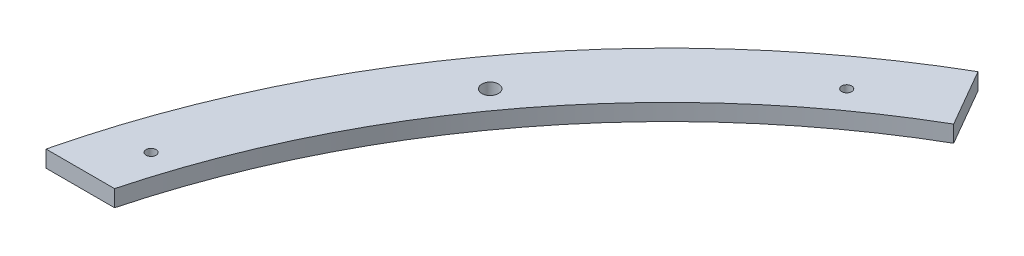
from build123d import *

# Parameters (mm, degrees)
SKETCH1_R           = 254.5
SKETCH1_R_2         = 234.5
BOSS_EXTRUDE1_DEPTH = 5
SKETCH2_W           = 27.805822748
SKETCH2_H           = 60
CUT_EXTRUDE1_DEPTH  = 5
SKETCH3_R           = 2.5
CUT_EXTRUDE2_DEPTH  = 5
SKETCH4_R           = 1.5
CUT_EXTRUDE3_DEPTH  = 5
SKETCH5_W           = 651.212620435
SKETCH5_H           = 357.226439325
CUT_EXTRUDE4_DEPTH  = 10
CUT_EXTRUDE5_START  = -10
CUT_EXTRUDE5_DEPTH  = 10


with BuildPart() as part:
    # Sketch1 → Boss-Extrude1 (new body)
    with BuildSketch(Plane(origin=(0, 0, 0), x_dir=(1, 0, 0), z_dir=(0, 1, 0))):
        with Locations(Location((0, 0, 0), (0, 0, 270))):
            Circle(SKETCH1_R)
        with Locations(Location((0, 0, 0), (0, 0, 270))):
            Circle(SKETCH1_R_2, mode=Mode.SUBTRACT)
    extrude(amount=BOSS_EXTRUDE1_DEPTH)

    # Sketch2 → Cut-Extrude1 (cut)
    with BuildSketch(Plane(origin=(0, 5, 0), x_dir=(1, 0, 0), z_dir=(0, 1, 0))):
        with Locations((-240.597088626, 30)):
            Rectangle(SKETCH2_W, SKETCH2_H)
    cut_extrude1 = extrude(amount=-CUT_EXTRUDE1_DEPTH, mode=Mode.SUBTRACT)

    # Mirror1: Cut-Extrude1 across plane
    add(cut_extrude1.mirror(Plane.XY), mode=Mode.SUBTRACT)

    # Sketch3 → Cut-Extrude2 (cut)
    with BuildSketch(Plane(origin=(0, 5, 0), x_dir=(1, 0, 0), z_dir=(0, 1, 0))):
        with Locations(Location((242.5, 0, 0), (0, 0, 270))):
            Circle(SKETCH3_R)
        with Locations(Location((196.186621136, -142.537923681, 0), (0, 0, 270))):
            Circle(SKETCH3_R)
        with Locations(Location((74.936621136, -230.631205202, 0), (0, 0, 270))):
            Circle(SKETCH3_R)
        with Locations(Location((-74.936621136, -230.631205202, 0), (0, 0, 270))):
            Circle(SKETCH3_R)
        with Locations(Location((-196.186621136, -142.537923681, 0), (0, 0, 270))):
            Circle(SKETCH3_R)
        with Locations((-242.5, 0)):
            Circle(SKETCH3_R)
        with Locations(Location((-196.186621136, 142.537923681, 0), (0, 0, 270))):
            Circle(SKETCH3_R)
        with Locations(Location((-74.936621136, 230.631205202, 0), (0, 0, 270))):
            Circle(SKETCH3_R)
        with Locations(Location((74.936621136, 230.631205202, 0), (0, 0, 270))):
            Circle(SKETCH3_R)
        with Locations(Location((196.186621136, 142.537923681, 0), (0, 0, 270))):
            Circle(SKETCH3_R)
    extrude(amount=-CUT_EXTRUDE2_DEPTH, mode=Mode.SUBTRACT)

    # Sketch4 → Cut-Extrude3 (cut)
    with BuildSketch(Plane(origin=(0, 5, 0), x_dir=(1, 0, 0), z_dir=(0, 1, 0))):
        with Locations(Location((0, -242.5, 0), (0, 0, 270))):
            Circle(SKETCH4_R)
        with Locations(Location((-142.537923681, -196.186621136, 0), (0, 0, 270))):
            Circle(SKETCH4_R)
        with Locations(Location((-230.631205202, -74.936621136, 0), (0, 0, 270))):
            Circle(SKETCH4_R)
        with Locations(Location((-230.631205202, 74.936621136, 0), (0, 0, 270))):
            Circle(SKETCH4_R)
        with Locations(Location((-142.537923681, 196.186621136, 0), (0, 0, 270))):
            Circle(SKETCH4_R)
        with Locations(Location((0, 242.5, 0), (0, 0, 270))):
            Circle(SKETCH4_R)
        with Locations(Location((142.537923681, 196.186621136, 0), (0, 0, 270))):
            Circle(SKETCH4_R)
        with Locations(Location((230.631205202, 74.936621136, 0), (0, 0, 270))):
            Circle(SKETCH4_R)
        with Locations(Location((230.631205202, -74.936621136, 0), (0, 0, 270))):
            Circle(SKETCH4_R)
        with Locations(Location((142.537923681, -196.186621136, 0), (0, 0, 270))):
            Circle(SKETCH4_R)
    extrude(amount=-CUT_EXTRUDE3_DEPTH, mode=Mode.SUBTRACT)

    # Sketch5 → Cut-Extrude4 (cut)
    with BuildSketch(Plane(origin=(0, 5, 0), x_dir=(1, 0, 0), z_dir=(0, 1, 0))):
        with Locations((-71.106310217, -178.613219663)):
            Rectangle(SKETCH5_W, SKETCH5_H)
    extrude(amount=-CUT_EXTRUDE4_DEPTH, mode=Mode.SUBTRACT)

    # Sketch6 → Cut-Extrude5 (cut)
    with BuildSketch(Plane(origin=(0, 5, 0), x_dir=(1, 0, 0), z_dir=(0, 1, 0)).offset(CUT_EXTRUDE5_START)):
        with BuildLine():
            Line((254.5, 0), (0, 0))
            Line((0, 0), (-127.25, 220.403465263))
            ThreePointArc((-127.25, 220.403465263), (127.25, 220.403465263), (254.5, 0))
        make_face()
    extrude(amount=CUT_EXTRUDE5_DEPTH, mode=Mode.SUBTRACT)


solid = part.part
